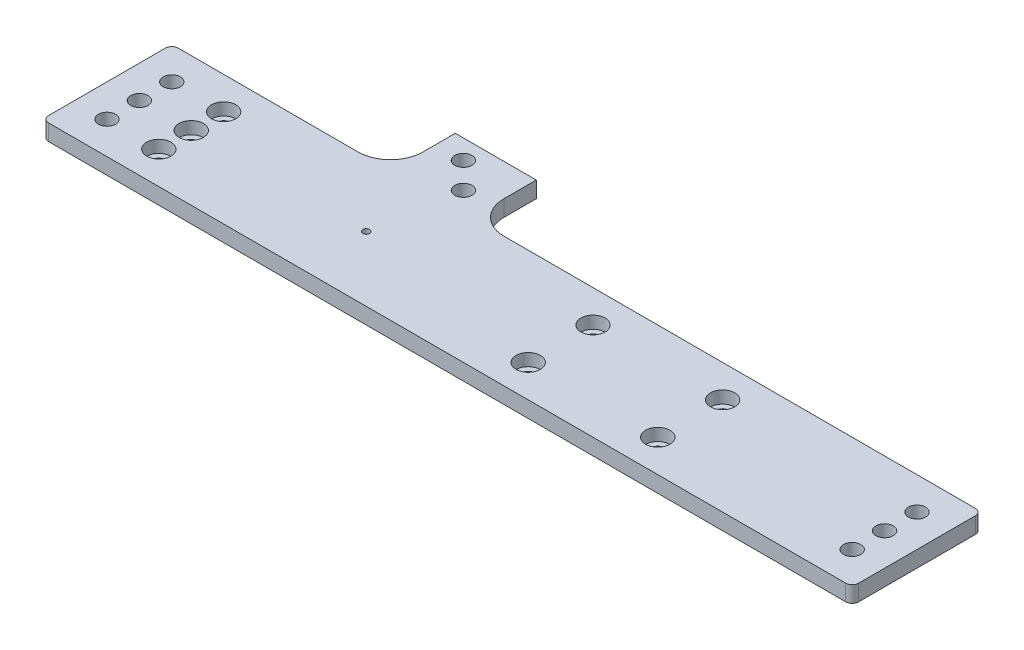
from build123d import *

# Parameters (mm, degrees)
SKETCH1_W                                       = 317.5
SKETCH1_H                                       = 50.8
BOSS_EXTRUDE1_DEPTH                             = 6.35
CBORE_FOR_10_SOCKET_HEAD_CAP_SCREW1_D           = 5.1054
CBORE_FOR_10_SOCKET_HEAD_CAP_SCREW1_CBORE_D     = 9.525
CBORE_FOR_10_SOCKET_HEAD_CAP_SCREW1_CBORE_DEPTH = 4.826
F_1_4_CLEARANCE_HOLE2_D                         = 6.7564
F_6_32_TAPPED_HOLE1_D                           = 2.7051
SKETCH12_W                                      = 31.75
SKETCH12_H                                      = 25.4
BOSS_EXTRUDE3_DEPTH                             = 6.35
F_1_4_CLEARANCE_HOLE1_D                         = 6.7564
FILLET1_R                                       = 12.7
FILLET2_R                                       = 2.54


with BuildPart() as part:
    # Sketch1 → Boss-Extrude1 (new body)
    with BuildSketch(Plane(origin=(0, 0, 0), x_dir=(1, 0, 0), z_dir=(0, 1, 0))):
        Rectangle(SKETCH1_W, SKETCH1_H)
    extrude(amount=BOSS_EXTRUDE1_DEPTH)

    # CBORE for #10 Socket Head Cap Screw1 (through all)
    with Locations(Plane(origin=(0, 6.35, 0), x_dir=(1, 0, 0), z_dir=(0, 1, 0))):
        with Locations((-125.73, -12.7), (19.05, 12.7), (69.85, 12.7), (19.05, -12.7), (69.85, -12.7), (-125.73, 12.7), (-125.73, 0)):
            CounterBoreHole(CBORE_FOR_10_SOCKET_HEAD_CAP_SCREW1_D / 2, CBORE_FOR_10_SOCKET_HEAD_CAP_SCREW1_CBORE_D / 2, CBORE_FOR_10_SOCKET_HEAD_CAP_SCREW1_CBORE_DEPTH)

    # 1/4 Clearance Hole2 (through all)
    with Locations(Plane.XZ):
        with Locations((-146.05, 12.7), (-146.05, 0), (-146.05, -12.7), (146.05, 12.7), (146.05, 0), (146.05, -12.7)):
            Hole(F_1_4_CLEARANCE_HOLE2_D / 2)

    # #6-32 Tapped Hole1 (through all)
    with Locations(Plane(origin=(0, 0, 0), x_dir=(-1, 0, 0), z_dir=(0, -1, 0))):
        with Locations((57.15, 0)):
            Hole(F_6_32_TAPPED_HOLE1_D / 2)

    # Sketch12 → Boss-Extrude3 (add)
    with BuildSketch(Plane(origin=(0, 6.35, 0), x_dir=(1, 0, 0), z_dir=(0, 1, 0))):
        with Locations((-57.15, 38.1)):
            Rectangle(SKETCH12_W, SKETCH12_H)
    extrude(amount=-BOSS_EXTRUDE3_DEPTH)

    # 1/4 Clearance Hole1 (through all)
    with Locations(Plane(origin=(0, 0, 0), x_dir=(-1, 0, 0), z_dir=(0, -1, 0))):
        with Locations((62.23, 43.18), (52.07, 33.02)):
            Hole(F_1_4_CLEARANCE_HOLE1_D / 2)

    # Fillet1
    fillet1_edges = [part.edges().sort_by_distance(p)[0] for p in [
        (-73.025, 3.175, -25.4),
        (-41.275, 3.175, -25.4),
    ]]
    fillet(fillet1_edges, radius=FILLET1_R)

    # Fillet2
    fillet2_edges = [part.edges().sort_by_distance(p)[0] for p in [
        (158.75, 3.175, 25.4),
        (-158.75, 3.175, 25.4),
        (-158.75, 3.175, -25.4),
        (158.75, 3.175, -25.4),
    ]]
    fillet(fillet2_edges, radius=FILLET2_R)


solid = part.part
